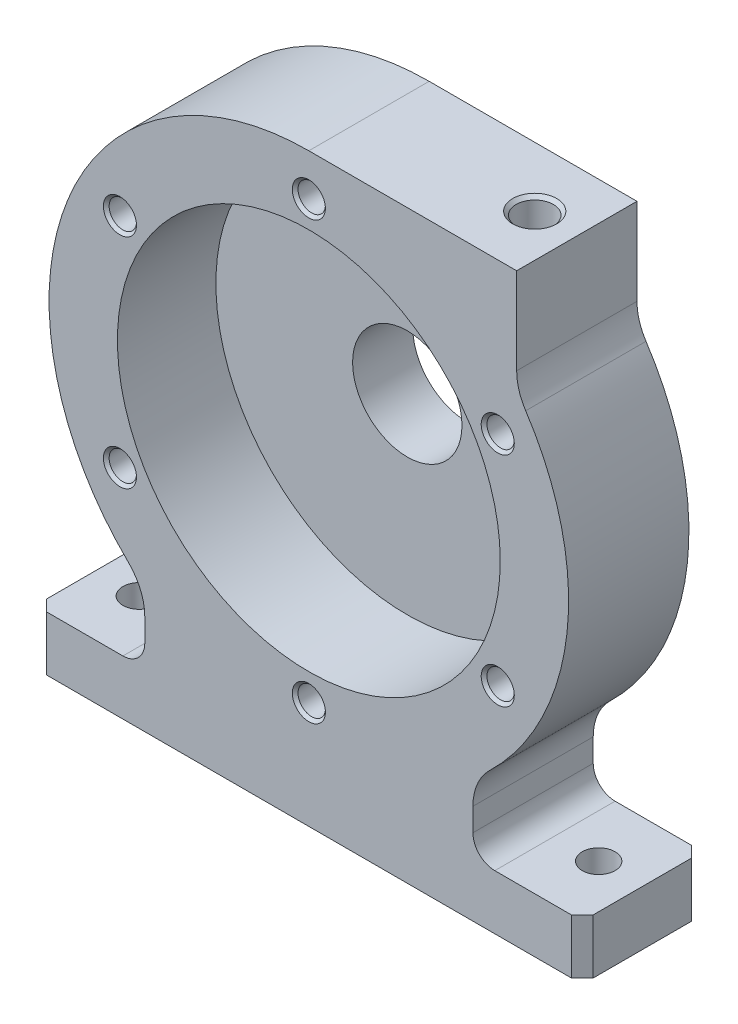
from build123d import *

# Parameters (mm, degrees)
BOSS_EXTRUDE1_DEPTH                                 = 22
SKETCH2_R                                           = 35
CUT_EXTRUDE1_DEPTH                                  = 18
SKETCH3_R                                           = 14
BOSS_EXTRUDE2_DEPTH                                 = 7
FILLET1_R                                           = 4
SKETCH4_R                                           = 10
CUT_EXTRUDE2_DEPTH                                  = 83.953300115
CHAMFER1_SIZE                                       = 2
M8X1_25_TAPPED_HOLE1_D                              = 6.8
M8X1_25_TAPPED_HOLE1_DEPTH                          = 29.75
M8X1_25_TAPPED_HOLE1_CSINK_D                        = 8.05
M8X1_25_TAPPED_HOLE1_CSINK_ANGLE                    = 90
M8X1_25_TAPPED_HOLE1_TIP                            = 2.042926105
CIRPATTERN1_COUNT                                   = 6
CSK_FOR_M8_COUNTERSUNK_FLAT_HEAD_SCREW1_D           = 6
CSK_FOR_M8_COUNTERSUNK_FLAT_HEAD_SCREW1_DEPTH       = 20
CSK_FOR_M8_COUNTERSUNK_FLAT_HEAD_SCREW1_CSINK_D     = 8
CSK_FOR_M8_COUNTERSUNK_FLAT_HEAD_SCREW1_CSINK_ANGLE = 90
CSK_FOR_M8_COUNTERSUNK_FLAT_HEAD_SCREW1_TIP         = 1.802581857


with BuildPart() as part:
    # Sketch1 → Boss-Extrude1 (new body)
    with BuildSketch(Plane.XY):
        with BuildLine():
            Line((-50, -59.5), (50, -59.5))
            Line((50, -59.5), (50, -49.5))
            Line((50, -49.5), (34, -49.5))
            ThreePointArc((34, -49.5), (31.171572875, -48.328427125), (30, -45.5))
            Line((30, -45.5), (30, -41.306779105))
            ThreePointArc((30, -41.306779105), (30.792252789, -37.405831617), (33.043478261, -34.122991434))
            ThreePointArc((33.043478261, -34.122991434), (47.217043986, -5.176944775), (39.652173913, 26.152535326))
            ThreePointArc((39.652173913, 26.152535326), (38.421945373, 28.784159388), (38, 31.658332237))
            Line((38, 31.658332237), (38, 47.5))
            Line((38, 47.5), (0, 47.5))
            ThreePointArc((0, 47.5), (-44.028922841, 17.824251834), (-33.043478261, -34.122991434))
            ThreePointArc((-33.043478261, -34.122991434), (-30.792252789, -37.405831617), (-30, -41.306779105))
            Line((-30, -41.306779105), (-30, -45.5))
            ThreePointArc((-30, -45.5), (-31.171572875, -48.328427125), (-34, -49.5))
            Line((-34, -49.5), (-50, -49.5))
            Line((-50, -49.5), (-50, -59.5))
        make_face()
    extrude(amount=BOSS_EXTRUDE1_DEPTH)

    # Sketch2 → Cut-Extrude1 (cut)
    with BuildSketch(Plane.XY.offset(22)):
        Circle(SKETCH2_R)
    extrude(amount=-CUT_EXTRUDE1_DEPTH, mode=Mode.SUBTRACT)

    # Sketch3 → Boss-Extrude2 (add)
    with BuildSketch(Plane(origin=(0, 0, 0), x_dir=(-1, 0, 0), z_dir=(0, 0, -1))):
        with Locations(Location((0, 0, 0), (0, 0, 180))):
            Circle(SKETCH3_R)
    extrude(amount=BOSS_EXTRUDE2_DEPTH)

    # Fillet1
    fillet1_edges = [part.edges().sort_by_distance(p)[0] for p in [
        (-14, 0, 0),
    ]]
    fillet(fillet1_edges, radius=FILLET1_R)

    # Sketch4 → Cut-Extrude2 (cut, through all)
    with BuildSketch(Plane(origin=(0, 0, -7), x_dir=(-1, 0, 0), z_dir=(0, 0, -1))):
        Circle(SKETCH4_R)
    extrude(amount=-CUT_EXTRUDE2_DEPTH, mode=Mode.SUBTRACT)

    # Chamfer1
    chamfer1_edges = [part.edges().sort_by_distance(p)[0] for p in [
        (50, -54.5, 0),
        (-50, -54.5, 0),
        (-50, -54.5, 22),
        (50, -54.5, 22),
    ]]
    chamfer(chamfer1_edges, length=CHAMFER1_SIZE)

    # M8x1.25 Tapped Hole1
    with Locations(Plane(origin=(0, 47.5, 0), x_dir=(1, 0, 0), z_dir=(0, 1, 0))):
        with Locations((30.22415, -10.919516186)):
            CounterSinkHole(M8X1_25_TAPPED_HOLE1_D / 2, M8X1_25_TAPPED_HOLE1_CSINK_D / 2, depth=M8X1_25_TAPPED_HOLE1_DEPTH, counter_sink_angle=M8X1_25_TAPPED_HOLE1_CSINK_ANGLE)
            with Locations((0, 0, -(M8X1_25_TAPPED_HOLE1_DEPTH + M8X1_25_TAPPED_HOLE1_TIP / 2))):  # 118° drill point
                Cone(0, M8X1_25_TAPPED_HOLE1_D / 2, M8X1_25_TAPPED_HOLE1_TIP, mode=Mode.SUBTRACT)

    # Sketch10 → M6x1.0 Tapped Hole1 (revolve, cut)
    with BuildSketch(Plane(origin=(0, 39.887207207, 22), x_dir=(0, -1, 0), z_dir=(1, 0, 0))):
        Polygon((0, 0), (0, 16.502151548), (2.5, 15), (2.5, 0.525), (3.025, 0), align=None)
    m6x1_0_tapped_hole1 = revolve(axis=Axis((0, 39.887207207, 28.35), (0, 0, -1)), mode=Mode.SUBTRACT)

    # CirPattern1: M6x1.0 Tapped Hole1 ×6 about axis
    cirpattern1_axis = Axis((0, 0, 0), (0, 0, 1))
    for i in range(1, CIRPATTERN1_COUNT):
        add(m6x1_0_tapped_hole1.rotate(cirpattern1_axis, i * 360 / CIRPATTERN1_COUNT), mode=Mode.SUBTRACT)

    # CSK for M8 Countersunk Flat Head Screw1
    with Locations(Plane(origin=(0, -59.5, 0), x_dir=(-1, 0, 0), z_dir=(0, -1, 0))):
        with Locations((42, -11), (-42, -11)):
            CounterSinkHole(CSK_FOR_M8_COUNTERSUNK_FLAT_HEAD_SCREW1_D / 2, CSK_FOR_M8_COUNTERSUNK_FLAT_HEAD_SCREW1_CSINK_D / 2, depth=CSK_FOR_M8_COUNTERSUNK_FLAT_HEAD_SCREW1_DEPTH, counter_sink_angle=CSK_FOR_M8_COUNTERSUNK_FLAT_HEAD_SCREW1_CSINK_ANGLE)
            with Locations((0, 0, -(CSK_FOR_M8_COUNTERSUNK_FLAT_HEAD_SCREW1_DEPTH + CSK_FOR_M8_COUNTERSUNK_FLAT_HEAD_SCREW1_TIP / 2))):  # 118° drill point
                Cone(0, CSK_FOR_M8_COUNTERSUNK_FLAT_HEAD_SCREW1_D / 2, CSK_FOR_M8_COUNTERSUNK_FLAT_HEAD_SCREW1_TIP, mode=Mode.SUBTRACT)


solid = part.part
